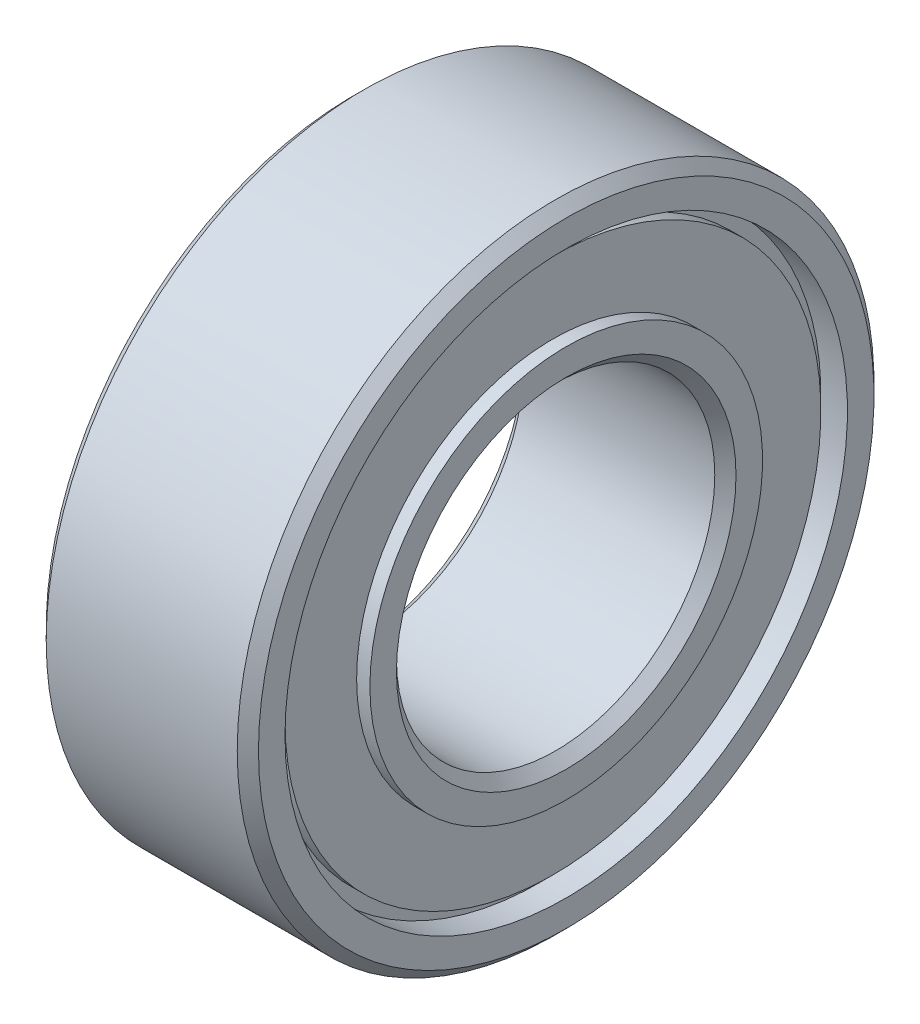
from build123d import *

# Parameters (mm, degrees)
CHAMFER_1_SIZE = 0.2


with BuildPart() as part:
    # 草图1 → 旋转1 (revolve)
    with BuildSketch(Plane.XY, mode=Mode.PRIVATE) as revolve_1_sk:
        Polygon((-2, 3), (2, 3), (2, 3.7), (1.75, 3.7), (1.75, 5.05), (1.5, 5.05), (1.5, 5.3), (2, 5.3), (2, 6), (-2, 6), (-2, 5.3), (-1.5, 5.3), (-1.5, 5.05), (-1.75, 5.05), (-1.75, 3.7), (-2, 3.7), align=None)
    revolve(revolve_1_sk.sketch.rotate(Axis((-3.90102381, 0, 0), (1, 0, 0)), 90), axis=Axis((-3.90102381, 0, 0), (1, 0, 0)))

    # 倒角1
    chamfer_1_edges = [part.edges().sort_by_distance(p)[0] for p in [
        (-2, 0, -6),
        (2, 0, -6),
        (2, 0, -3),
        (-2, 0, -3),
    ]]
    chamfer(chamfer_1_edges, length=CHAMFER_1_SIZE)


solid = part.part
